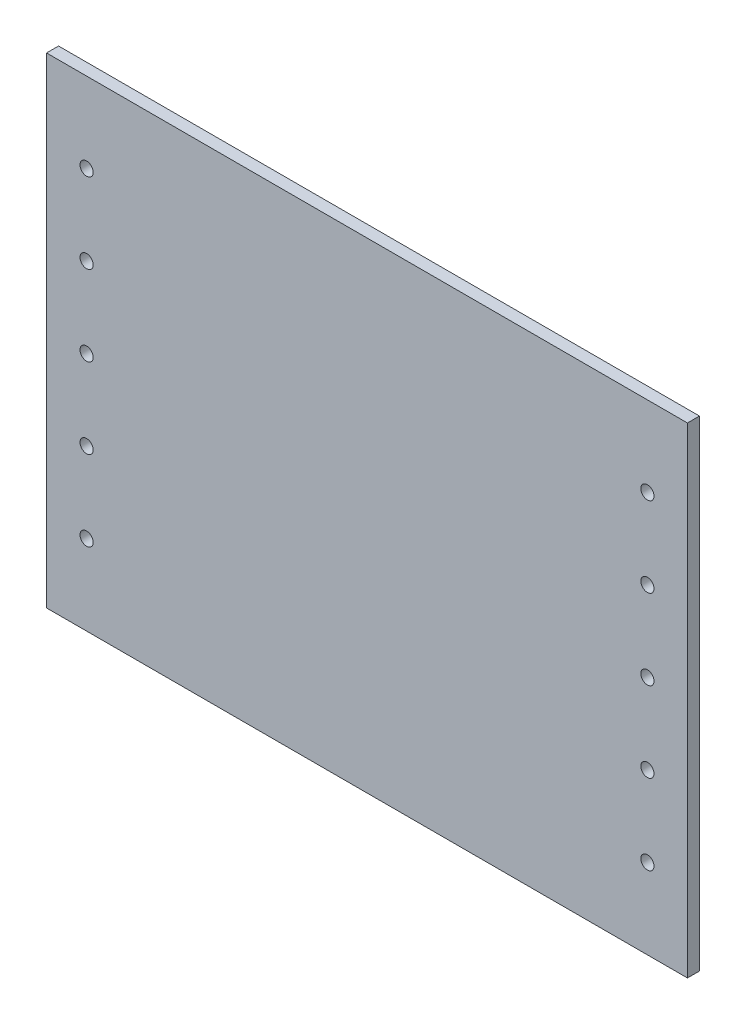
from build123d import *

# Parameters (mm, degrees)
SKETCH_1_W      = 160
SKETCH_1_H      = 120
SKETCH_1_R      = 1.65
EXTRUDE_1_DEPTH = 3


with BuildPart() as part:
    # 草图1 → 凸台-拉伸1 (new body)
    with BuildSketch(Plane.XY):
        Rectangle(SKETCH_1_W, SKETCH_1_H)
        with Locations((-70, 40)):
            Circle(SKETCH_1_R, mode=Mode.SUBTRACT)
        with Locations((-70, 20)):
            Circle(SKETCH_1_R, mode=Mode.SUBTRACT)
        with Locations((-70, 0)):
            Circle(SKETCH_1_R, mode=Mode.SUBTRACT)
        with Locations((-70, -20)):
            Circle(SKETCH_1_R, mode=Mode.SUBTRACT)
        with Locations((-70, -40)):
            Circle(SKETCH_1_R, mode=Mode.SUBTRACT)
        with Locations(Location((70, -40, 0), (0, 0, 180))):
            Circle(SKETCH_1_R, mode=Mode.SUBTRACT)
        with Locations(Location((70, -20, 0), (0, 0, 180))):
            Circle(SKETCH_1_R, mode=Mode.SUBTRACT)
        with Locations(Location((70, 0, 0), (0, 0, 180))):
            Circle(SKETCH_1_R, mode=Mode.SUBTRACT)
        with Locations(Location((70, 20, 0), (0, 0, 180))):
            Circle(SKETCH_1_R, mode=Mode.SUBTRACT)
        with Locations(Location((70, 40, 0), (0, 0, 180))):
            Circle(SKETCH_1_R, mode=Mode.SUBTRACT)
    extrude(amount=EXTRUDE_1_DEPTH)


solid = part.part
